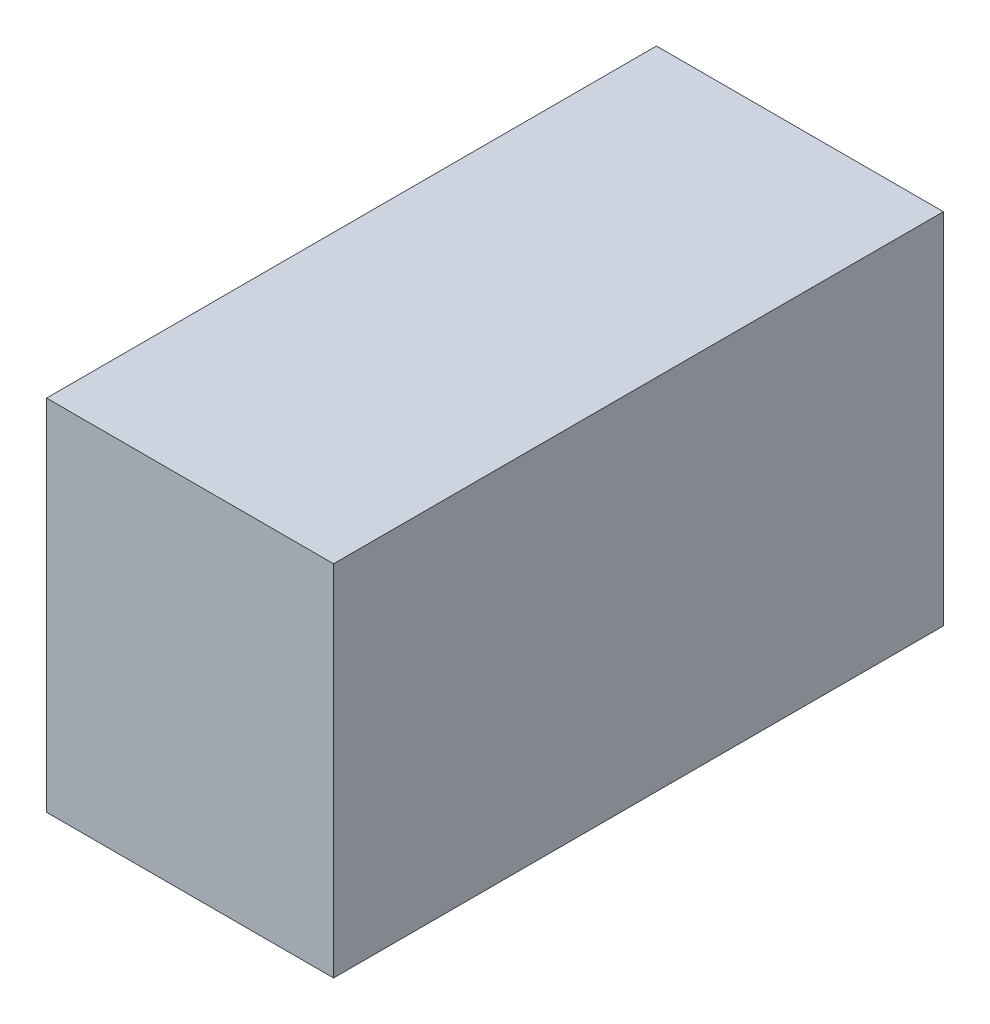
from build123d import *

# Parameters (mm, degrees)
SKETCH1_W            = 25.4
SKETCH1_H            = 31.75
BOSS_EXTRUDE1_DEPTH  = 26.9875
SKETCH2_W            = 24.892
SKETCH2_H            = 31.242
BOSS_EXTRUDE2_DEPTH  = 26.7335
CUT_EXTRUDE1_DEPTH   = 41.157964307
MIRROR2_COPY_1_DEPTH = 41.157964307
CUT_EXTRUDE2_DEPTH   = 44.37756531
MIRROR4_COPY_1_DEPTH = 44.37756531
SKETCH6_R            = 5.75437
CUT_EXTRUDE3_DEPTH   = 12.446
SKETCH7_R            = 7.34187
CUT_EXTRUDE5_DEPTH   = 6.096


with BuildPart() as part:
    # Sketch1 → Boss-Extrude1 (new, symmetric)
    with BuildSketch(Plane.XY):
        Rectangle(SKETCH1_W, SKETCH1_H)
    extrude(amount=BOSS_EXTRUDE1_DEPTH, both=True)


with BuildPart() as body_2:
    # Sketch2 → Boss-Extrude2 (new, symmetric)
    with BuildSketch(Plane.XY):
        Rectangle(SKETCH2_W, SKETCH2_H)
    extrude(amount=BOSS_EXTRUDE2_DEPTH, both=True)

    # Sketch3 → Cut-Extrude1 (cut, through all)
    with BuildSketch(Plane(origin=(12.446, 0, 0), x_dir=(0, 0, -1), z_dir=(1, 0, 0))):
        Polygon((-26.7335, 11.722289012), (-20.3835, 14.0335), (-20.3835, 15.621), (-26.7335, 15.621), align=None)
    cut_extrude1 = extrude(amount=-CUT_EXTRUDE1_DEPTH, mode=Mode.SUBTRACT)

    # Mirror1: Cut-Extrude1 across plane
    add(cut_extrude1.mirror(Plane.ZX), mode=Mode.SUBTRACT)

    # Mirror2: Cut-Extrude1 across plane
    add(cut_extrude1.mirror(Plane.XY), mode=Mode.SUBTRACT)

    # Mirror2 copy 1 sketch → Mirror2 copy 1 (cut, through all)
    with BuildSketch(Plane(origin=(12.446, 0, 0), x_dir=(0, 0, 1), z_dir=(1, 0, 0))):
        Polygon((-26.7335, 11.722289012), (-20.3835, 14.0335), (-20.3835, 15.621), (-26.7335, 15.621), align=None)
    extrude(amount=-MIRROR2_COPY_1_DEPTH, mode=Mode.SUBTRACT)

    # Sketch4 → Cut-Extrude2 (cut, symmetric)
    with BuildSketch(Plane(origin=(0, 15.621, 0), x_dir=(1, 0, 0), z_dir=(0, 1, 0))):
        Polygon((-12.446, 26.7335), (-12.446, 20.3835), (-10.8585, 20.3835), (-8.547289012, 26.7335), align=None)
    cut_extrude2 = extrude(amount=CUT_EXTRUDE2_DEPTH, both=True, mode=Mode.SUBTRACT)

    # Mirror3: Cut-Extrude2 across plane
    add(cut_extrude2.mirror(Plane(origin=(0, 0, 0), x_dir=(0, 0, 1), z_dir=(1, 0, 0))), mode=Mode.SUBTRACT)

    # Mirror4: Cut-Extrude2 across plane
    add(cut_extrude2.mirror(Plane.XY), mode=Mode.SUBTRACT)

    # Mirror4 copy 1 sketch → Mirror4 copy 1 (cut, symmetric)
    with BuildSketch(Plane(origin=(0, 15.621, 0), x_dir=(-1, 0, 0), z_dir=(0, 1, 0))):
        Polygon((-12.446, 26.7335), (-12.446, 20.3835), (-10.8585, 20.3835), (-8.547289012, 26.7335), align=None)
    extrude(amount=MIRROR4_COPY_1_DEPTH, both=True, mode=Mode.SUBTRACT)

    # Sketch6 → Cut-Extrude3 (cut)
    with BuildSketch(Plane.XZ.offset(15.621)):
        with Locations(Location((0, 0, 0), (0, 0, 270))):
            Circle(SKETCH6_R)
    extrude(amount=-CUT_EXTRUDE3_DEPTH, mode=Mode.SUBTRACT)

    # Sketch7 → Cut-Extrude5 (cut)
    with BuildSketch(Plane.XZ.offset(15.621)):
        with Locations(Location((0, 0, 0), (0, 0, 270))):
            Circle(SKETCH7_R)
    extrude(amount=-CUT_EXTRUDE5_DEPTH, mode=Mode.SUBTRACT)


solid = Compound([part.part, body_2.part])
